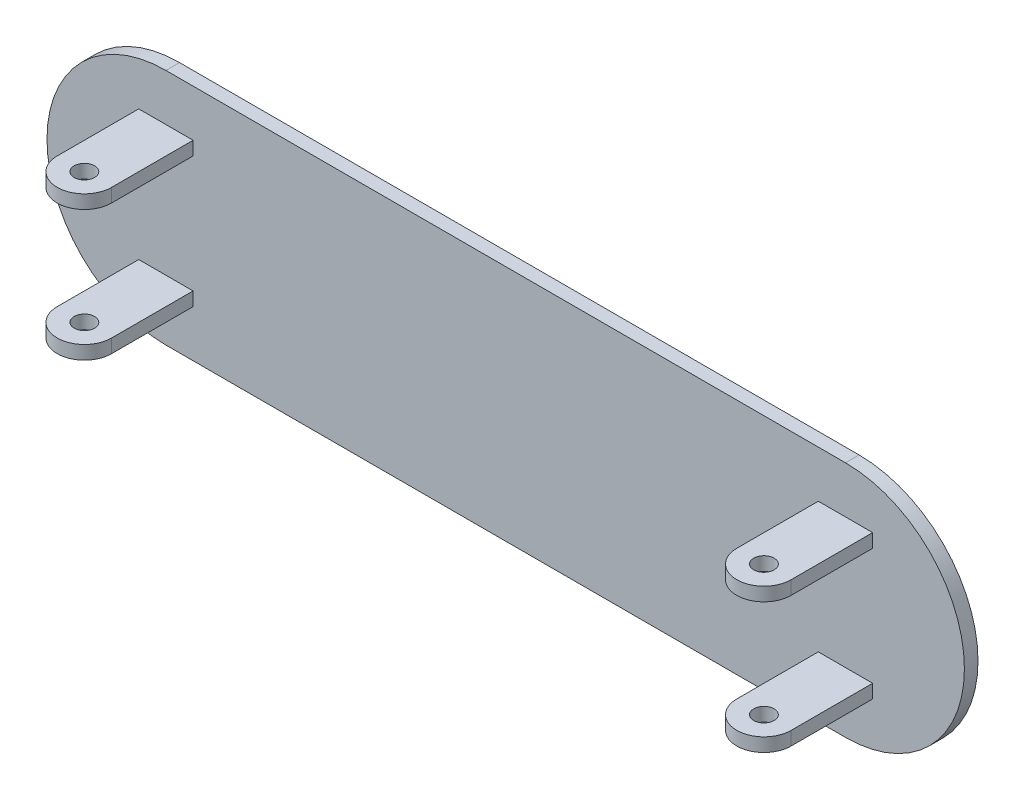
from build123d import *

# Parameters (mm, degrees)
BOSS_EXTRUDE3_DEPTH     = 1
SKETCH2_W               = 8
SKETCH2_H               = 2
BOSS_EXTRUDE4_DEPTH     = 20
SKETCH5_R               = 1.5
CUT_EXTRUDE1_DEPTH      = 2
MIRROR2_COPY_1_SKETCH_W = 8
MIRROR2_COPY_1_SKETCH_H = 2
MIRROR2_COPY_1_DEPTH    = 20
MIRROR2_COPY_2_SKETCH_R = 1.5
MIRROR2_COPY_2_DEPTH    = 2


with BuildPart() as part:
    # Sketch1 → Boss-Extrude3 (new, symmetric)
    with BuildSketch(Plane.XY):
        with BuildLine():
            Line((-50, 17.5), (50, 17.5))
            ThreePointArc((50, 17.5), (67.5, 0), (50, -17.5))
            Line((50, -17.5), (-50, -17.5))
            ThreePointArc((-50, -17.5), (-67.5, 0), (-50, 17.5))
        make_face()
    extrude(amount=BOSS_EXTRUDE3_DEPTH, both=True)

    # Sketch2 → Boss-Extrude4 (add)
    with BuildSketch(Plane.XY.offset(1)):
        with Locations((-50, 9.6)):
            Rectangle(SKETCH2_W, SKETCH2_H)
    boss_extrude4 = extrude(amount=BOSS_EXTRUDE4_DEPTH)

    # Sketch5 → Cut-Extrude1 (cut)
    with BuildSketch(Plane.XZ.offset(-8.6)):
        with Locations(Location((-50, 13, 0), (0, 0, 270))):
            Circle(SKETCH5_R)
        with BuildLine():
            Line((-54, 13), (-54, 21))
            Line((-54, 21), (-46, 21))
            Line((-46, 21), (-46, 13))
            ThreePointArc((-46, 13), (-50, 17), (-54, 13))
        make_face()
    cut_extrude1 = extrude(amount=-CUT_EXTRUDE1_DEPTH, mode=Mode.SUBTRACT)

    # Mirror1: Boss-Extrude4, Cut-Extrude1 across plane
    add(boss_extrude4.mirror(Plane.ZX))
    add(cut_extrude1.mirror(Plane.ZX), mode=Mode.SUBTRACT)

    # Mirror2: Boss-Extrude4, Cut-Extrude1 across plane
    add(boss_extrude4.mirror(Plane(origin=(0, 0, 0), x_dir=(0, 0, 1), z_dir=(1, 0, 0))))
    add(cut_extrude1.mirror(Plane(origin=(0, 0, 0), x_dir=(0, 0, 1), z_dir=(1, 0, 0))), mode=Mode.SUBTRACT)

    # Mirror2 copy 1 sketch → Mirror2 copy 1 (add)
    with BuildSketch(Plane(origin=(0, 0, 1), x_dir=(-1, 0, 0), z_dir=(0, 0, 1))):
        with Locations((-50, 9.6)):
            Rectangle(MIRROR2_COPY_1_SKETCH_W, MIRROR2_COPY_1_SKETCH_H)
    extrude(amount=MIRROR2_COPY_1_DEPTH)

    # Mirror2 copy 2 sketch → Mirror2 copy 2 (cut)
    with BuildSketch(Plane(origin=(0, -8.6, 0), x_dir=(-1, 0, 0), z_dir=(0, 1, 0))):
        with Locations(Location((-50, 13, 0), (0, 0, 270))):
            Circle(MIRROR2_COPY_2_SKETCH_R)
        with BuildLine():
            Line((-54, 13), (-54, 21))
            Line((-54, 21), (-46, 21))
            Line((-46, 21), (-46, 13))
            ThreePointArc((-46, 13), (-50, 17), (-54, 13))
        make_face()
    extrude(amount=-MIRROR2_COPY_2_DEPTH, mode=Mode.SUBTRACT)


solid = part.part
